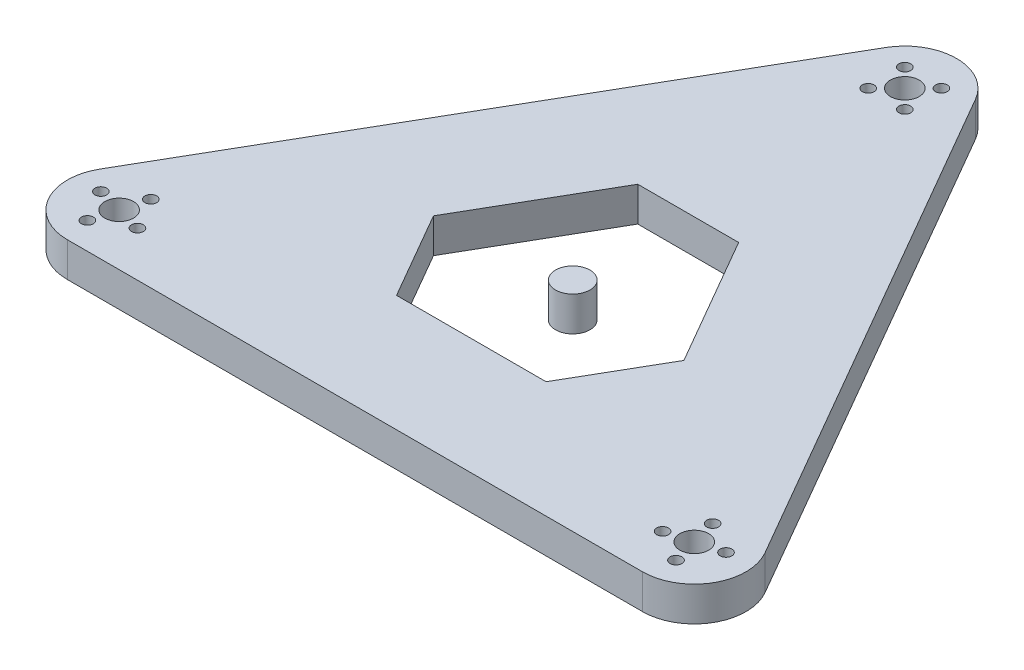
from build123d import *

# Parameters (mm, degrees)
SKETCH1_R             = 6
BOSS_EXTRUDE1_DEPTH   = 12
SKETCH1_R_2           = 5
SKETCH1_R_3           = 2.05
BOSS_EXTRUDE1_2_DEPTH = 12


with BuildPart() as part:
    # Sketch1 → Boss-Extrude1 (new body)
    with BuildSketch(Plane(origin=(0, 0, 0), x_dir=(1, 0, 0), z_dir=(0, 1, 0))):
        with Locations(Location((0, 0, 0), (0, 0, 270))):
            Circle(SKETCH1_R)
    extrude(amount=BOSS_EXTRUDE1_DEPTH)


with BuildPart() as body_2:
    # Sketch1 → Boss-Extrude1 2 (new body)
    with BuildSketch(Plane(origin=(0, 0, 0), x_dir=(1, 0, 0), z_dir=(0, 1, 0))):
        with BuildLine():
            Line((-15.588457268, 124.470053838), (-115.588457268, -48.735026919))
            ThreePointArc((-115.588457268, -48.735026919), (-115.588457268, -66.735026919), (-100, -75.735026919))
            Line((-100, -75.735026919), (100, -75.735026919))
            ThreePointArc((100, -75.735026919), (115.588457268, -66.735026919), (115.588457268, -48.735026919))
            Line((115.588457268, -48.735026919), (15.588457268, 124.470053838))
            ThreePointArc((15.588457268, 124.470053838), (0, 133.470053838), (-15.588457268, 124.470053838))
        make_face()
        with Locations(Location((0, 115.470053838, 0), (0, 0, 270))):
            Circle(SKETCH1_R_2, mode=Mode.SUBTRACT)
        with Locations(Location((-6.363961031, 121.834014869, 0), (0, 0, 270))):
            Circle(SKETCH1_R_3, mode=Mode.SUBTRACT)
        with Locations(Location((-6.363961031, 109.106092807, 0), (0, 0, 270))):
            Circle(SKETCH1_R_3, mode=Mode.SUBTRACT)
        with Locations(Location((6.363961031, 109.106092807, 0), (0, 0, 270))):
            Circle(SKETCH1_R_3, mode=Mode.SUBTRACT)
        with Locations(Location((6.363961031, 121.834014869, 0), (0, 0, 270))):
            Circle(SKETCH1_R_3, mode=Mode.SUBTRACT)
        with Locations(Location((100, -57.735026919, 0), (0, 0, 270))):
            Circle(SKETCH1_R_2, mode=Mode.SUBTRACT)
        with Locations(Location((-100, -57.735026919, 0), (0, 0, 270))):
            Circle(SKETCH1_R_2, mode=Mode.SUBTRACT)
        with Locations(Location((91.306667563, -60.064398325, 0), (0, 0, 270))):
            Circle(SKETCH1_R_3, mode=Mode.SUBTRACT)
        with Locations(Location((102.329371406, -66.428359356, 0), (0, 0, 270))):
            Circle(SKETCH1_R_3, mode=Mode.SUBTRACT)
        with Locations(Location((108.693332437, -55.405655513, 0), (0, 0, 270))):
            Circle(SKETCH1_R_3, mode=Mode.SUBTRACT)
        with Locations(Location((97.670628594, -49.041694482, 0), (0, 0, 270))):
            Circle(SKETCH1_R_3, mode=Mode.SUBTRACT)
        with Locations(Location((-108.693332437, -55.405655513, 0), (0, 0, 270))):
            Circle(SKETCH1_R_3, mode=Mode.SUBTRACT)
        with Locations(Location((-102.329371406, -66.428359356, 0), (0, 0, 270))):
            Circle(SKETCH1_R_3, mode=Mode.SUBTRACT)
        with Locations(Location((-91.306667563, -60.064398325, 0), (0, 0, 270))):
            Circle(SKETCH1_R_3, mode=Mode.SUBTRACT)
        with Locations(Location((-97.670628594, -49.041694482, 0), (0, 0, 270))):
            Circle(SKETCH1_R_3, mode=Mode.SUBTRACT)
        Polygon((-17.536180574, 40.152844192), (17.536180574, 40.152844192), (43.541473392, -4.889644233), (26.005292817, -35.263199959), (-26.005292817, -35.263199959), (-43.541473392, -4.889644233), align=None, mode=Mode.SUBTRACT)
    extrude(amount=BOSS_EXTRUDE1_2_DEPTH)


solid = Compound([part.part, body_2.part])
